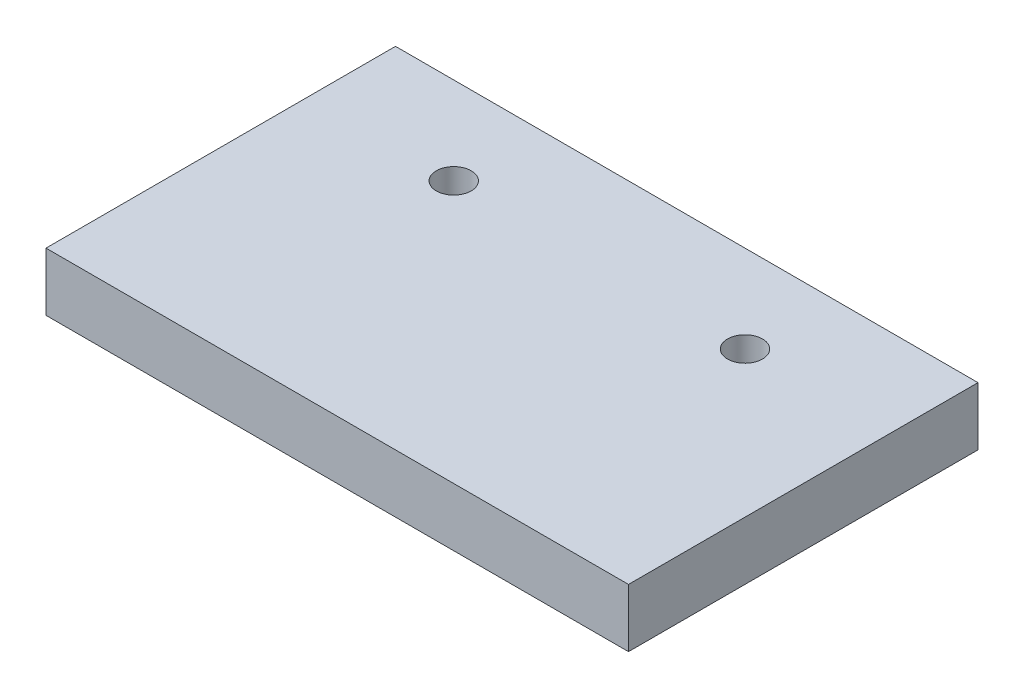
from build123d import *

# Parameters (mm, degrees)
SKETCH_1_W          = 100
SKETCH_1_H          = 60
EXTRUDE_1_DEPTH     = 10
SKETCH_2_R          = 3
CUT_EXTRUDE_1_DEPTH = 20


with BuildPart() as part:
    # 草图1 → 凸台-拉伸1 (new body)
    with BuildSketch(Plane(origin=(0, 0, 0), x_dir=(1, 0, 0), z_dir=(0, 1, 0))):
        Rectangle(SKETCH_1_W, SKETCH_1_H)
    extrude(amount=EXTRUDE_1_DEPTH)

    # 草图2 → 切除-拉伸1 (cut)
    with BuildSketch(Plane(origin=(0, 0, 0), x_dir=(1, 0, 0), z_dir=(0, 1, 0))):
        with Locations(Location((25, 15, 0), (0, 0, 90))):
            Circle(SKETCH_2_R)
    cut_extrude_1 = extrude(amount=CUT_EXTRUDE_1_DEPTH, mode=Mode.SUBTRACT)

    # 镜向1: 切除-拉伸1 across plane
    add(cut_extrude_1.mirror(Plane(origin=(0, 0, 0), x_dir=(0, 0, 1), z_dir=(1, 0, 0))), mode=Mode.SUBTRACT)


solid = part.part
